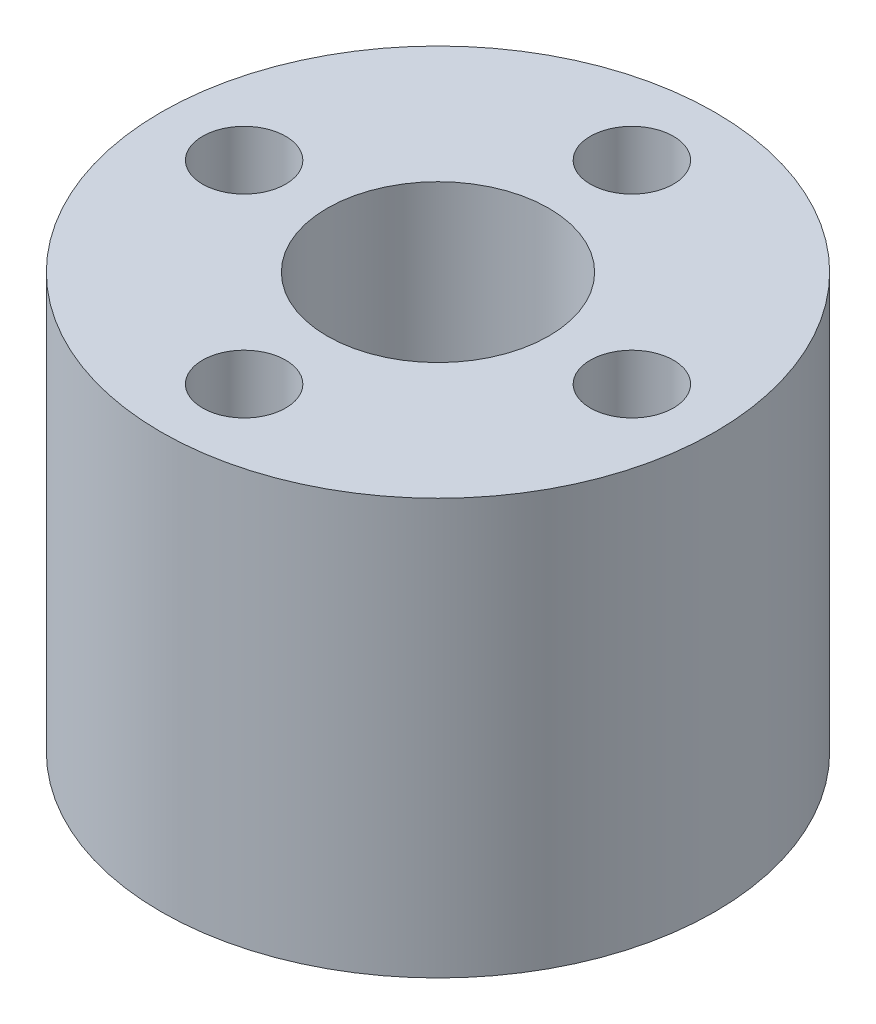
from build123d import *

# Parameters (mm, degrees)
SKETCH_1_R      = 10
SKETCH_1_R_2    = 1.5
SKETCH_1_R_3    = 4
EXTRUDE_1_DEPTH = 15


with BuildPart() as part:
    # 草图1 → 凸台-拉伸1 (new body)
    with BuildSketch(Plane(origin=(0, 0, 0), x_dir=(1, 0, 0), z_dir=(0, 1, 0))):
        with Locations(Location((0, 0, 0), (0, 0, 270))):
            Circle(SKETCH_1_R)
        with Locations(Location((0, 7, 0), (0, 0, 270))):
            Circle(SKETCH_1_R_2, mode=Mode.SUBTRACT)
        with Locations(Location((-7, 0, 0), (0, 0, 270))):
            Circle(SKETCH_1_R_2, mode=Mode.SUBTRACT)
        with Locations(Location((0, -7, 0), (0, 0, 270))):
            Circle(SKETCH_1_R_2, mode=Mode.SUBTRACT)
        with Locations(Location((7, 0, 0), (0, 0, 270))):
            Circle(SKETCH_1_R_2, mode=Mode.SUBTRACT)
        with Locations(Location((0, 0, 0), (0, 0, 270))):
            Circle(SKETCH_1_R_3, mode=Mode.SUBTRACT)
    extrude(amount=EXTRUDE_1_DEPTH)


solid = part.part
